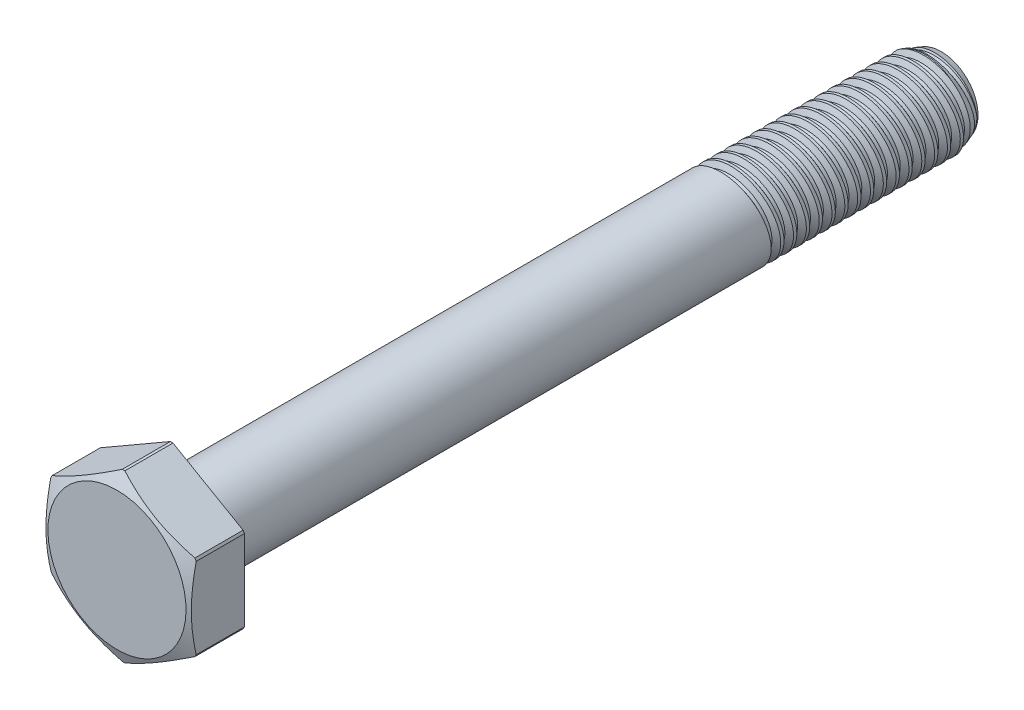
from build123d import *

# Parameters (mm, degrees)
SKETCH1_W       = 90
SKETCH1_H       = 5
LPATTERN1_COUNT = 17
LPATTERN1_PITCH = 1.5
EXTRUDE1_DEPTH  = 6.4


with BuildPart() as part:
    # Sketch1 → Revolve1 (revolve)
    with BuildSketch(Plane(origin=(0, 0, 0), x_dir=(0, 0, -1), z_dir=(1, 0, 0))):
        with Locations((45, 2.5)):
            Rectangle(SKETCH1_W, SKETCH1_H)
    revolve(axis=Axis((0, 0, 0), (0, 0, 1)))

    # Sketch2 → Cut-Revolve1 (revolve, cut)
    with BuildSketch(Plane(origin=(0, 0, 0), x_dir=(0, 0, -1), z_dir=(1, 0, 0)), mode=Mode.PRIVATE) as cut_revolve1_sk:
        Polygon((64.185425566, 5.027813835), (65.483404529, 5.222510679), (65.140278052, 4.350059838), (64.76942692, 4.294432168), align=None)
    cut_revolve1 = revolve(cut_revolve1_sk.sketch.rotate(Axis((0, -0.240478408, -64), (0, 0.1483404529302449, -0.9889363528682975)), 180), axis=Axis((0, -0.240478408, -64), (0, 0.1483404529302449, -0.9889363528682975)), mode=Mode.SUBTRACT)

    # Sketch3 → Cut-Revolve2 (revolve, cut)
    with BuildSketch(Plane(origin=(0, 0, 0), x_dir=(0, 0, -1), z_dir=(1, 0, 0))):
        Polygon((90, 4.294432168), (88.061468314, 5), (90, 5), align=None)
    revolve(axis=Axis((0, 0, -88.061468314), (0, 0, 1)), mode=Mode.SUBTRACT)

    # LPattern1: Cut-Revolve1 ×17
    with Locations(*[(0, 0, -i * LPATTERN1_PITCH) for i in range(1, LPATTERN1_COUNT)]):
        add(cut_revolve1, mode=Mode.SUBTRACT)

    # Sketch4 → Extrude1 (add)
    with BuildSketch(Plane.XY):
        Polygon((0, 9.814954576), (-8.5, 4.907477288), (-8.5, -4.907477288), (0, -9.814954576), (8.5, -4.907477288), (8.5, 4.907477288), align=None)
    extrude(amount=EXTRUDE1_DEPTH)

    # Sketch9 → Cut-Revolve3 (revolve, cut)
    with BuildSketch(Plane(origin=(0, 0, 0), x_dir=(0, 0, -1), z_dir=(1, 0, 0)), mode=Mode.PRIVATE) as cut_revolve3_sk:
        Polygon((-6.4, 8.075), (-5.629213563, 9.727956847), (0, 9.727956847), (0, 9.814954576), (-6.4, 9.814954576), align=None)
    revolve(cut_revolve3_sk.sketch.rotate(Axis((0, 0, 0), (0, 0, 1)), 143.674674308), axis=Axis((0, 0, 0), (0, 0, 1)), mode=Mode.SUBTRACT)


solid = part.part
